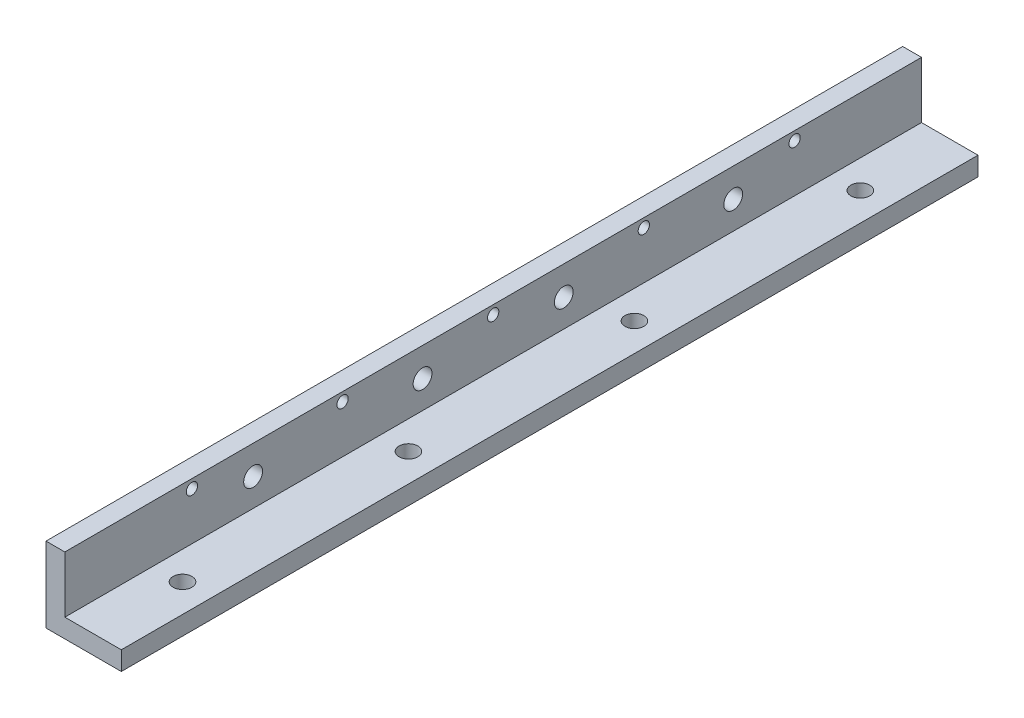
from build123d import *

# Parameters (mm, degrees)
BOSS_EXTRUDE1_DEPTH         = 227.5
TAP_DRILL_FOR_M5X0_8_TAP1_D = 5
F_5_0_5_DIAMETER_HOLE1_D    = 5
SKETCH9_R                   = 1.5
CUT_EXTRUDE1_DEPTH          = 29


with BuildPart() as part:
    # Sketch1 → Boss-Extrude1 (new body)
    with BuildSketch(Plane.XY):
        Polygon((0, 5), (0, 0), (5, 0), (20, 0), (20, 5), (5, 5), (5, 20), (0, 20), align=None)
    extrude(amount=BOSS_EXTRUDE1_DEPTH)

    # Tap Drill for M5x0.8 Tap1 (through all)
    with Locations(Plane(origin=(0, 5, 0), x_dir=(1, 0, 0), z_dir=(0, 1, 0))):
        with Locations((12.5, -203.75), (12.5, -143.75), (12.5, -83.75), (12.5, -23.75)):
            Hole(TAP_DRILL_FOR_M5X0_8_TAP1_D / 2)

    # Ø5.0 (5) Diameter Hole1 (through all)
    with Locations(Plane(origin=(5, 0, 0), x_dir=(0, 0, -1), z_dir=(1, 0, 0))):
        with Locations((-177.5, 12.346163158), (-132.5, 12.346163158), (-95, 12.346163158), (-50, 12.346163158)):
            Hole(F_5_0_5_DIAMETER_HOLE1_D / 2)

    # Sketch9 → Cut-Extrude1 (cut)
    with BuildSketch(Plane.ZY):
        with Locations((33.704207464, 17.6675)):
            Circle(SKETCH9_R)
        with Locations((73.75, 17.6675)):
            Circle(SKETCH9_R)
        with Locations((113.75, 17.6675)):
            Circle(SKETCH9_R)
        with Locations((153.75, 17.6675)):
            Circle(SKETCH9_R)
        with Locations((193.75, 17.6675)):
            Circle(SKETCH9_R)
    extrude(amount=-CUT_EXTRUDE1_DEPTH, mode=Mode.SUBTRACT)


solid = part.part
